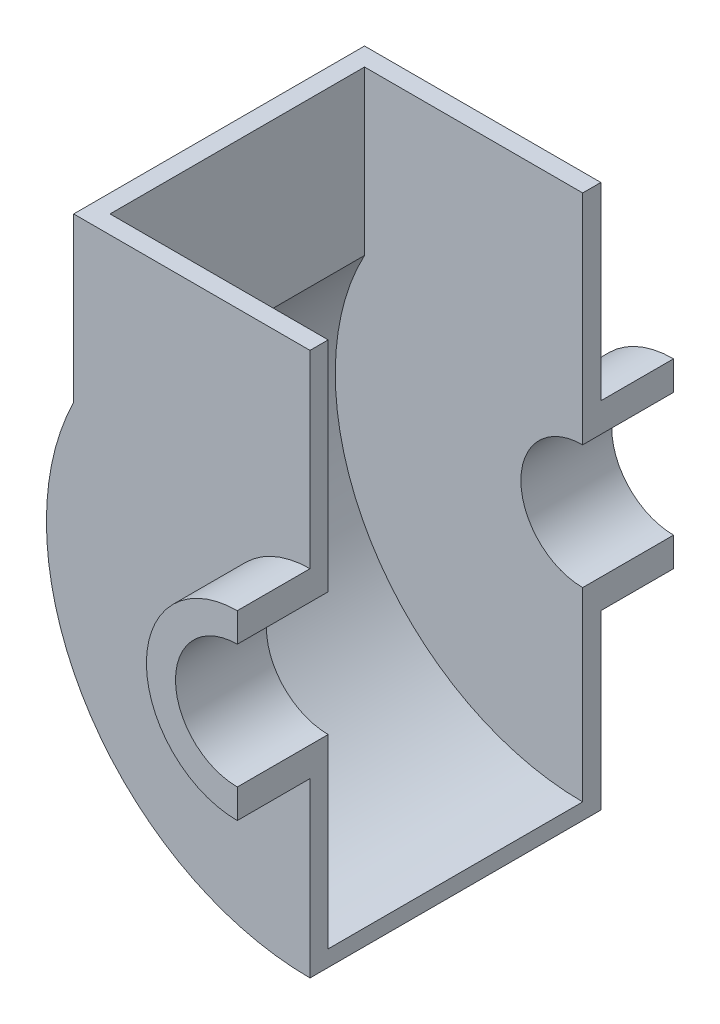
from build123d import *

# Parameters (mm, degrees)
BOSS_EXTRUDE1_DEPTH      = 20
BOSS_EXTRUDE1_DEPTH_BACK = 5
BOSS_EXTRUDE2_START      = -5
BOSS_EXTRUDE2_DEPTH      = 5
BOSS_EXTRUDE3_DEPTH      = 70


with BuildPart() as part:
    # Sketch1 → Boss-Extrude1 (new, two sides: drawn at the far end of the back side and taken through both)
    with BuildSketch(Plane.XY.offset(-BOSS_EXTRUDE1_DEPTH_BACK)):
        with BuildLine():
            Line((0, 25), (0, 17))
            ThreePointArc((0, 17), (-17, 0), (0, -17))
            Line((0, -17), (0, -25))
            ThreePointArc((0, -25), (-25, 0), (0, 25))
        make_face()
    extrude(amount=BOSS_EXTRUDE1_DEPTH + BOSS_EXTRUDE1_DEPTH_BACK)

    # Sketch2 → Boss-Extrude2 (add)
    with BuildSketch(Plane.XY.offset(BOSS_EXTRUDE2_START)):
        with BuildLine():
            Line((0, -25), (0, -72.5))
            ThreePointArc((0, -72.5), (-61.581037686, -38.262590053), (-65, 32.113081447))
            Line((-65, 32.113081447), (-65, 77))
            Line((-65, 77), (0, 77))
            Line((0, 77), (0, 25))
            Line((0, 25), (0, 17))
            ThreePointArc((0, 17), (-17, 0), (0, -17))
            Line((0, -17), (0, -25))
        make_face()
    extrude(amount=BOSS_EXTRUDE2_DEPTH)


with BuildPart() as body_2:
    # Mirror8: mirrored copy
    add(part.part.mirror(Plane.XY.offset(-40)))


with BuildPart() as part_1:
    add(part.part)

    add(body_2.part)  # Boss-Extrude3 merges body 2
    # Sketch3 → Boss-Extrude3 (add)
    with BuildSketch(Plane.XY.offset(-75)):
        with BuildLine():
            Line((-65, 32.113081447), (-65, 77))
            Line((-65, 77), (-60, 77))
            Line((-60, 77), (-60, 32.113081447))
            ThreePointArc((-60, 32.113081447), (-58.380864924, -34.970339014), (0, -68.053287944))
            Line((0, -68.053287944), (0, -72.5))
            ThreePointArc((0, -72.5), (-61.581037686, -38.262590053), (-65, 32.113081447))
        make_face()
    extrude(amount=BOSS_EXTRUDE3_DEPTH)


solid = part_1.part
